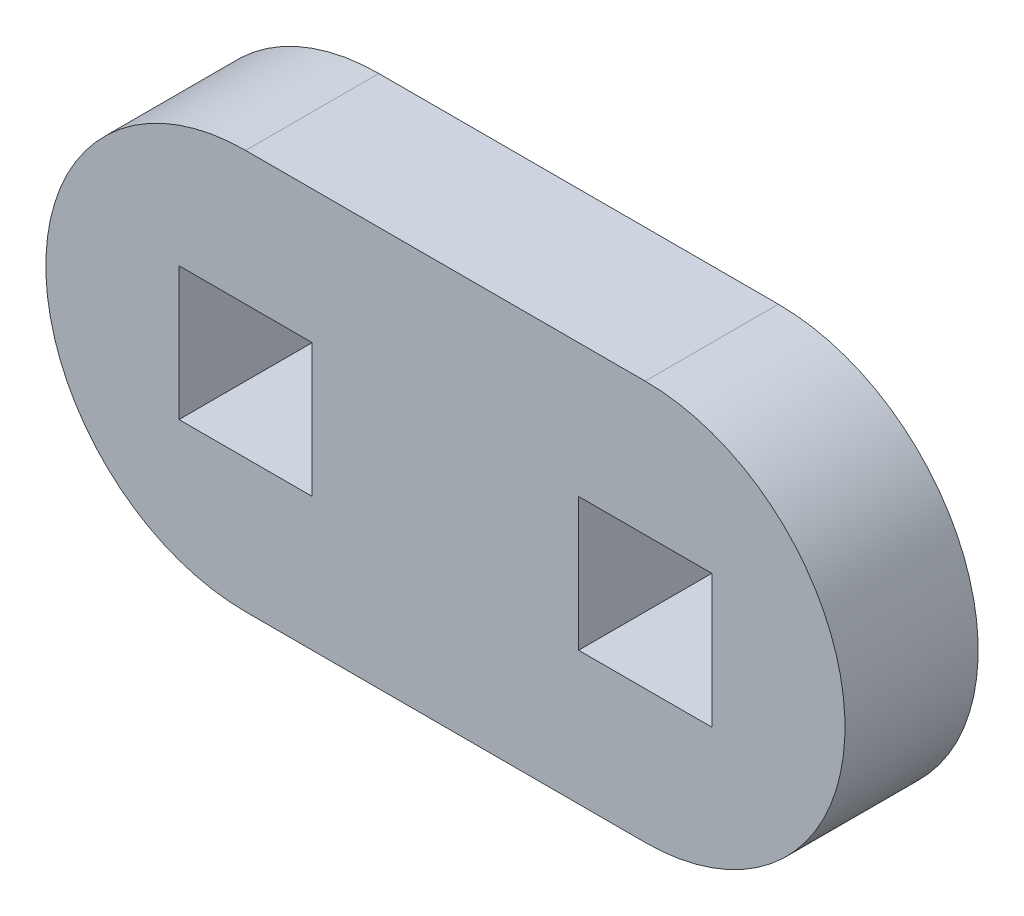
from build123d import *

# Parameters (mm, degrees)
MODEL_W                 = 3
MODEL_H                 = 3
SALIENTE_EXTRUIR1_DEPTH = 3


with BuildPart() as part:
    # Model → Saliente-Extruir1 (new body)
    with BuildSketch(Plane.XY):
        with BuildLine():
            Line((12.603795093, 298.783404974), (21.603795093, 298.783404974))
            ThreePointArc((21.603795093, 298.783404974), (26.103795093, 294.283404974), (21.603795093, 289.783404974))
            Line((21.603795093, 289.783404974), (12.603795093, 289.783404974))
            ThreePointArc((12.603795093, 289.783404974), (8.103795093, 294.283404974), (12.603795093, 298.783404974))
        make_face()
        with Locations((12.603795093, 294.283404974)):
            Rectangle(MODEL_W, MODEL_H, mode=Mode.SUBTRACT)
        with Locations((21.603795093, 294.283404974)):
            Rectangle(MODEL_W, MODEL_H, mode=Mode.SUBTRACT)
    extrude(amount=SALIENTE_EXTRUIR1_DEPTH)


solid = part.part
